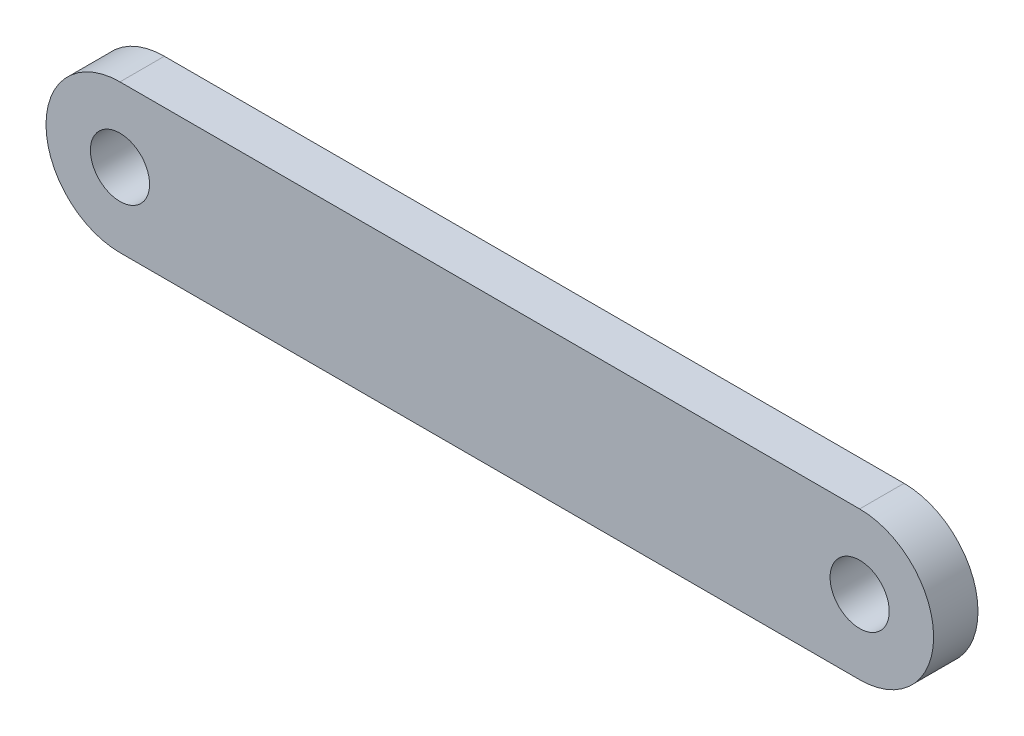
from build123d import *

# Parameters (mm, degrees)
SKETCH1_R           = 2
BOSS_EXTRUDE1_DEPTH = 3


with BuildPart() as part:
    # Sketch1 → Boss-Extrude1 (new body)
    with BuildSketch(Plane(origin=(0, 34.703080777, 0), x_dir=(1, 0, 0), z_dir=(0, 0, 1))):
        with BuildLine():
            Line((44.546209346, 243.403407485), (94.546209346, 243.403407485))
            ThreePointArc((94.546209346, 243.403407485), (99.546209346, 238.403407485), (94.546209346, 233.403407485))
            Line((94.546209346, 233.403407485), (44.546209346, 233.403407485))
            ThreePointArc((44.546209346, 233.403407485), (39.546209346, 238.403407485), (44.546209346, 243.403407485))
        make_face()
        with Locations((44.546209346, 238.403407485)):
            Circle(SKETCH1_R, mode=Mode.SUBTRACT)
        with Locations((94.546209346, 238.403407485)):
            Circle(SKETCH1_R, mode=Mode.SUBTRACT)
    extrude(amount=BOSS_EXTRUDE1_DEPTH)


solid = part.part
